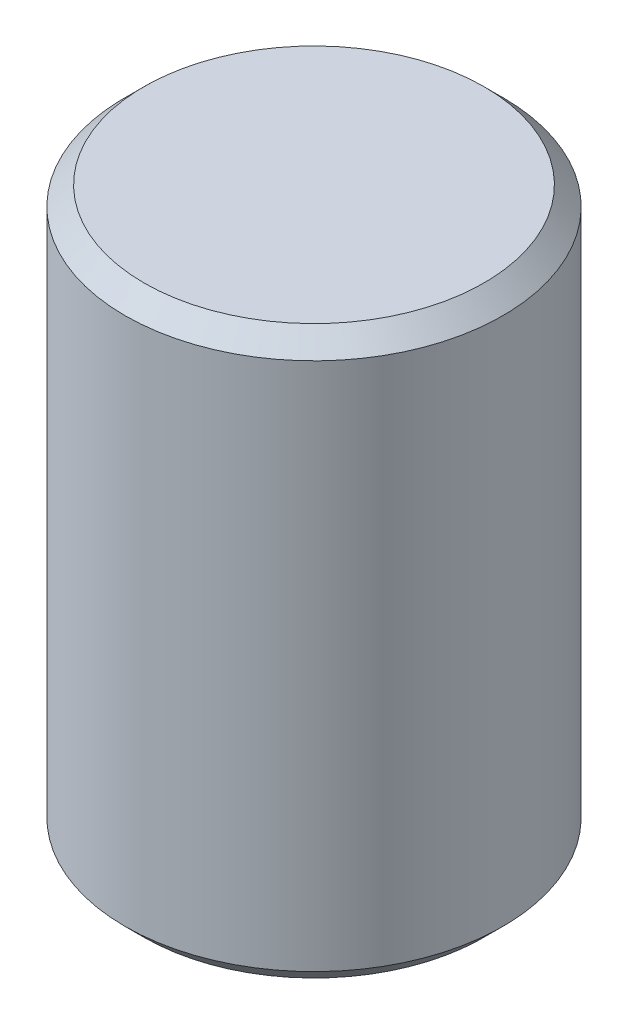
from build123d import *

# Parameters (mm, degrees)
SKETCH1_R        = 5
PEG_DEPTH        = 15
PEG_CHAMFER_SIZE = 0.5


with BuildPart() as part:
    # Sketch1 → Peg (new body)
    with BuildSketch(Plane(origin=(0, 0, 0), x_dir=(1, 0, 0), z_dir=(0, 1, 0))):
        with Locations(Location((-14.014901848, 2.464285714, 0), (0, 0, 270))):
            Circle(SKETCH1_R)
    extrude(amount=PEG_DEPTH)

    # Peg Chamfer
    peg_chamfer_edges = [part.edges().sort_by_distance(p)[0] for p in [
        (-14.014901848, 0, -7.464285714),
        (-14.014901848, 15, -7.464285714),
    ]]
    chamfer(peg_chamfer_edges, length=PEG_CHAMFER_SIZE)


solid = part.part
